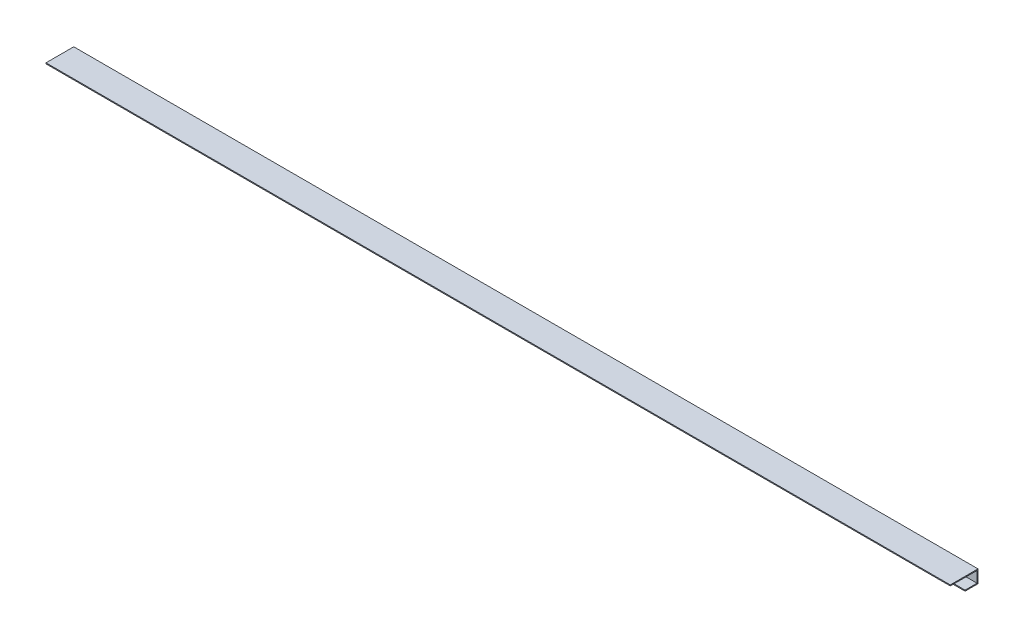
from build123d import *

# Parameters (mm, degrees)
BOSS_EXTRUDE1_DEPTH = 1890


with BuildPart() as part:
    # Sketch1 → Boss-Extrude1 (new body)
    with BuildSketch(Plane(origin=(0, 0, 0), x_dir=(0, 0, -1), z_dir=(1, 0, 0))):
        Polygon((0, 0), (58, 0), (58, -27), (31, -27), (31, -25), (56, -25), (56, -2), (0, -2), align=None)
    extrude(amount=BOSS_EXTRUDE1_DEPTH)


solid = part.part
